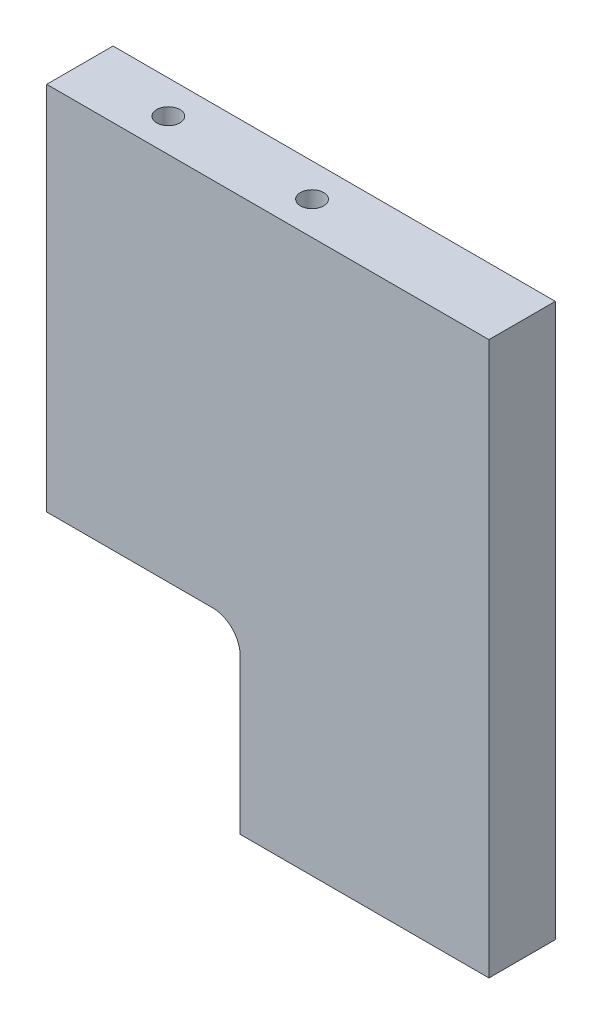
from build123d import *

# Parameters (mm, degrees)
EXTRUDE_1_DEPTH        = 12
FILLET_1_R             = 5
HOLE_WIZARD_M5_1_D     = 4.2
HOLE_WIZARD_M5_1_DEPTH = 12.4
HOLE_WIZARD_M5_1_TIP   = 1.2618073
HOLE_WIZARD_M5_2_D     = 4.2
HOLE_WIZARD_M5_2_DEPTH = 12.4
HOLE_WIZARD_M5_2_TIP   = 1.2618073


with BuildPart() as part:
    # 草图1 → 凸台-拉伸1 (new body)
    with BuildSketch(Plane.XY):
        Polygon((0, 0), (-45, 0), (-45, 33), (-80, 33), (-80, 100), (0, 100), align=None)
    extrude(amount=EXTRUDE_1_DEPTH)

    # 圆角1
    fillet_1_edges = [part.edges().sort_by_distance(p)[0] for p in [
        (-45, 33, 6),
    ]]
    fillet(fillet_1_edges, radius=FILLET_1_R)

    # M5 螺纹孔1
    with Locations(Plane.XZ):
        with Locations((-6, 6), (-21, 6)):
            Hole(HOLE_WIZARD_M5_1_D / 2, depth=HOLE_WIZARD_M5_1_DEPTH)
            with Locations((0, 0, -(HOLE_WIZARD_M5_1_DEPTH + HOLE_WIZARD_M5_1_TIP / 2))):  # 118° drill point
                Cone(0, HOLE_WIZARD_M5_1_D / 2, HOLE_WIZARD_M5_1_TIP, mode=Mode.SUBTRACT)

    # M5 螺纹孔2
    with Locations(Plane(origin=(0, 100, 0), x_dir=(-1, 0, 0), z_dir=(0, 1, 0))):
        with Locations((38, 6), (64, 6)):
            Hole(HOLE_WIZARD_M5_2_D / 2, depth=HOLE_WIZARD_M5_2_DEPTH)
            with Locations((0, 0, -(HOLE_WIZARD_M5_2_DEPTH + HOLE_WIZARD_M5_2_TIP / 2))):  # 118° drill point
                Cone(0, HOLE_WIZARD_M5_2_D / 2, HOLE_WIZARD_M5_2_TIP, mode=Mode.SUBTRACT)


solid = part.part
